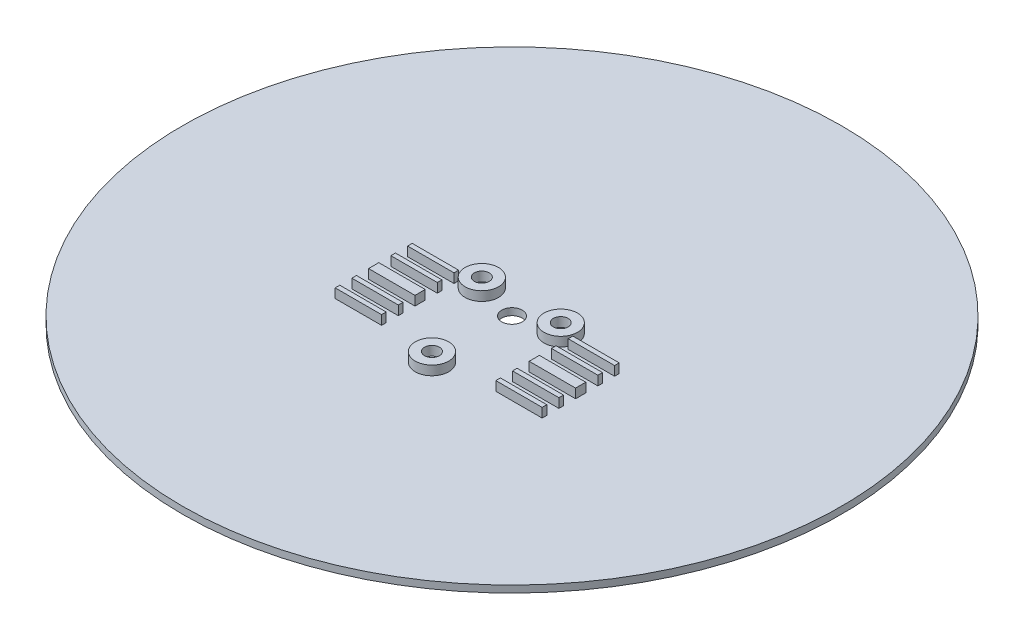
from build123d import *

# Parameters (mm, degrees)
SKETCH1_R           = 71
BOSS_EXTRUDE1_DEPTH = 1.5
SKETCH2_R           = 2.2
CUT_EXTRUDE1_DEPTH  = 14.5
SKETCH3_R           = 3.6
SKETCH3_R_2         = 1.6
BOSS_EXTRUDE2_DEPTH = 2
SKETCH4_W           = 10
SKETCH4_H           = 2.2
SKETCH4_H_2         = 0.995039414
SKETCH4_H_3         = 0.995528857
BOSS_EXTRUDE3_DEPTH = 2


with BuildPart() as part:
    # Sketch1 → Boss-Extrude1 (new body)
    with BuildSketch(Plane(origin=(0, 0, 0), x_dir=(1, 0, 0), z_dir=(0, 1, 0))):
        with Locations(Location((0, 0, 0), (0, 0, 270))):
            Circle(SKETCH1_R)
    extrude(amount=BOSS_EXTRUDE1_DEPTH)

    # Sketch2 → Cut-Extrude1 (cut)
    with BuildSketch(Plane(origin=(0, 1.5, 0), x_dir=(1, 0, 0), z_dir=(0, 1, 0))):
        with Locations(Location((0, 0, 0), (0, 0, 270))):
            Circle(SKETCH2_R)
    extrude(amount=-CUT_EXTRUDE1_DEPTH, mode=Mode.SUBTRACT)

    # Sketch3 → Boss-Extrude2 (add)
    # profile 1 of 3: a face of its own
    with BuildSketch(Plane(origin=(0, 1.5, 0), x_dir=(1, 0, 0), z_dir=(0, 1, 0))):
        with Locations(Location((-8.5, 2, 0), (0, 0, 270))):
            Circle(SKETCH3_R)
        with Locations(Location((-8.5, 2, 0), (0, 0, 270))):
            Circle(SKETCH3_R_2, mode=Mode.SUBTRACT)
    # profile 2 of 3: a face of its own
    with BuildSketch(Plane(origin=(0, 1.5, 0), x_dir=(1, 0, 0), z_dir=(0, 1, 0))):
        with Locations(Location((8.5, 2, 0), (0, 0, 270))):
            Circle(SKETCH3_R)
        with Locations(Location((8.5, 2, 0), (0, 0, 270))):
            Circle(SKETCH3_R_2, mode=Mode.SUBTRACT)
    # profile 3 of 3: a face of its own
    with BuildSketch(Plane(origin=(0, 1.5, 0), x_dir=(1, 0, 0), z_dir=(0, 1, 0))):
        with Locations(Location((0, -17.24, 0), (0, 0, 270))):
            Circle(SKETCH3_R)
        with Locations(Location((0, -17.24, 0), (0, 0, 270))):
            Circle(SKETCH3_R_2, mode=Mode.SUBTRACT)
    extrude(amount=BOSS_EXTRUDE2_DEPTH)

    # Sketch4 → Boss-Extrude3 (add)
    with BuildSketch(Plane(origin=(0, 1.5, 0), x_dir=(1, 0, 0), z_dir=(0, 1, 0))):
        with Locations((-17.3, -7.5)):
            Rectangle(SKETCH4_W, SKETCH4_H)
        with Locations((-17.3, -11.697519707)):
            Rectangle(SKETCH4_W, SKETCH4_H_2)
        with Locations((-17.3, -3.302235572)):
            Rectangle(SKETCH4_W, SKETCH4_H_3)
        with Locations((-17.3, 0.302235572)):
            Rectangle(SKETCH4_W, SKETCH4_H_3)
        with Locations((-17.3, -15.302480293)):
            Rectangle(SKETCH4_W, SKETCH4_H_2)
        with Locations((17.3, -15.302480293)):
            Rectangle(SKETCH4_W, SKETCH4_H_2)
        with Locations((17.3, -11.697519707)):
            Rectangle(SKETCH4_W, SKETCH4_H_2)
        with Locations((17.3, -7.5)):
            Rectangle(SKETCH4_W, SKETCH4_H)
        with Locations((17.3, -3.302235572)):
            Rectangle(SKETCH4_W, SKETCH4_H_3)
        with Locations((17.3, 0.302235572)):
            Rectangle(SKETCH4_W, SKETCH4_H_3)
    extrude(amount=BOSS_EXTRUDE3_DEPTH)


solid = part.part
